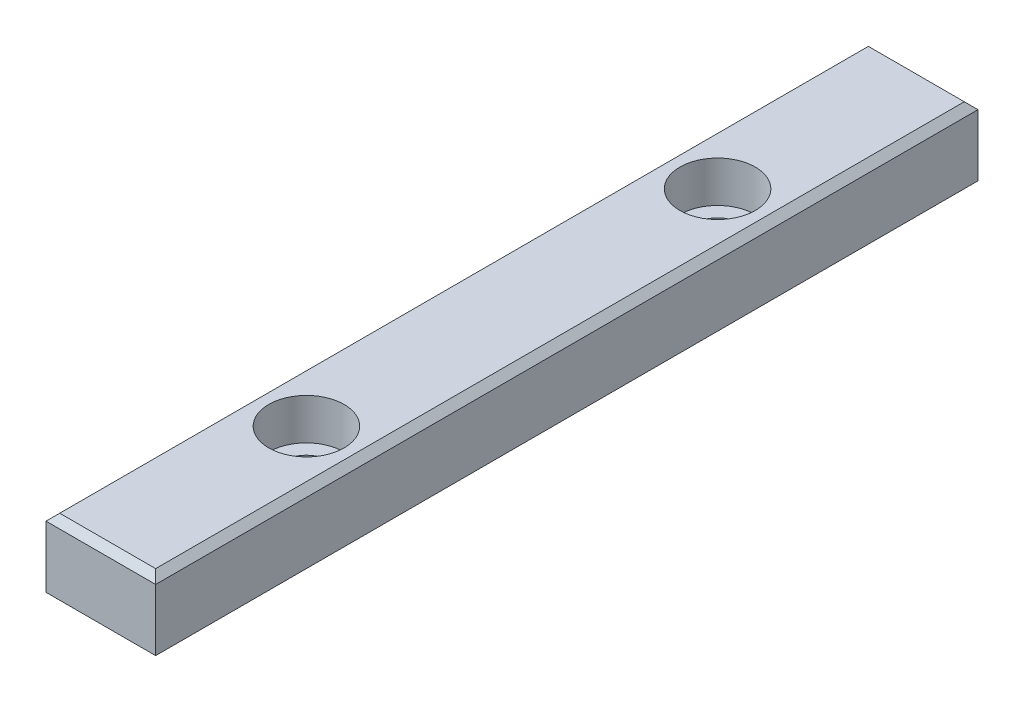
from build123d import *

# Parameters (mm, degrees)
SKETCH_1_W                  = 16
SKETCH_1_H                  = 120
EXTRUDE_1_DEPTH             = 10
CHAMFER_1_SIZE              = 1
HOLE_WIZARD_M61_D           = 6.6
HOLE_WIZARD_M61_CBORE_D     = 11
HOLE_WIZARD_M61_CBORE_DEPTH = 6


with BuildPart() as part:
    # Эскиз1 → Бобышка-Вытянуть1 (new body)
    with BuildSketch(Plane(origin=(0, 0, 0), x_dir=(1, 0, 0), z_dir=(0, 1, 0))):
        Rectangle(SKETCH_1_W, SKETCH_1_H)
    extrude(amount=-EXTRUDE_1_DEPTH)

    # Фаска1
    chamfer_1_edges = [part.edges().sort_by_distance(p)[0] for p in [
        (0, 0, 60),
        (-8, 0, 0),
        (0, 0, -60),
        (8, 0, 0),
    ]]
    chamfer(chamfer_1_edges, length=CHAMFER_1_SIZE)

    # Цековка для винта с внутренним шестигранником M61 (through all)
    with Locations(Plane(origin=(0, 0, 0), x_dir=(-1, 0, 0), z_dir=(0, 1, 0))):
        with Locations((0, 30), (0, -30)):
            CounterBoreHole(HOLE_WIZARD_M61_D / 2, HOLE_WIZARD_M61_CBORE_D / 2, HOLE_WIZARD_M61_CBORE_DEPTH)


solid = part.part
